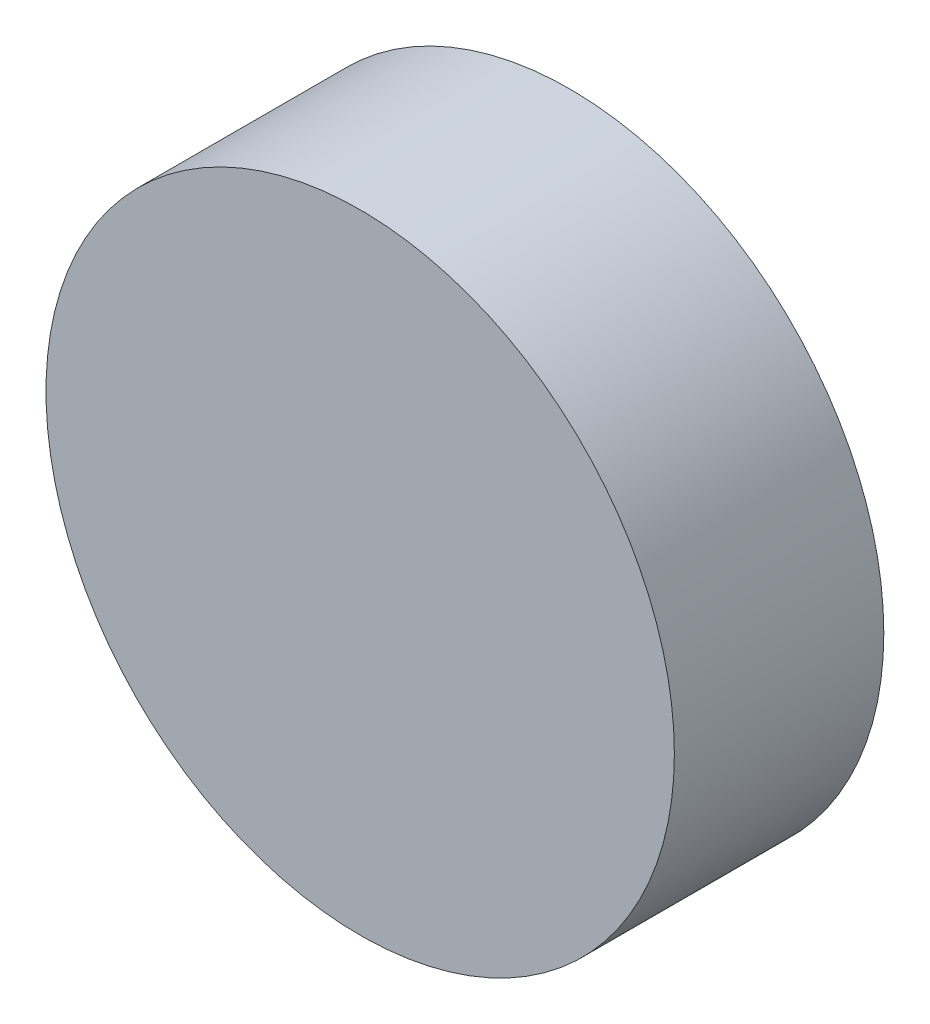
from build123d import *

# Parameters (mm, degrees)
SKETCH1_R           = 3
BOSS_EXTRUDE1_DEPTH = 2


with BuildPart() as part:
    # Sketch1 → Boss-Extrude1 (new body)
    with BuildSketch(Plane.XY):
        Circle(SKETCH1_R)
    extrude(amount=BOSS_EXTRUDE1_DEPTH)


solid = part.part
